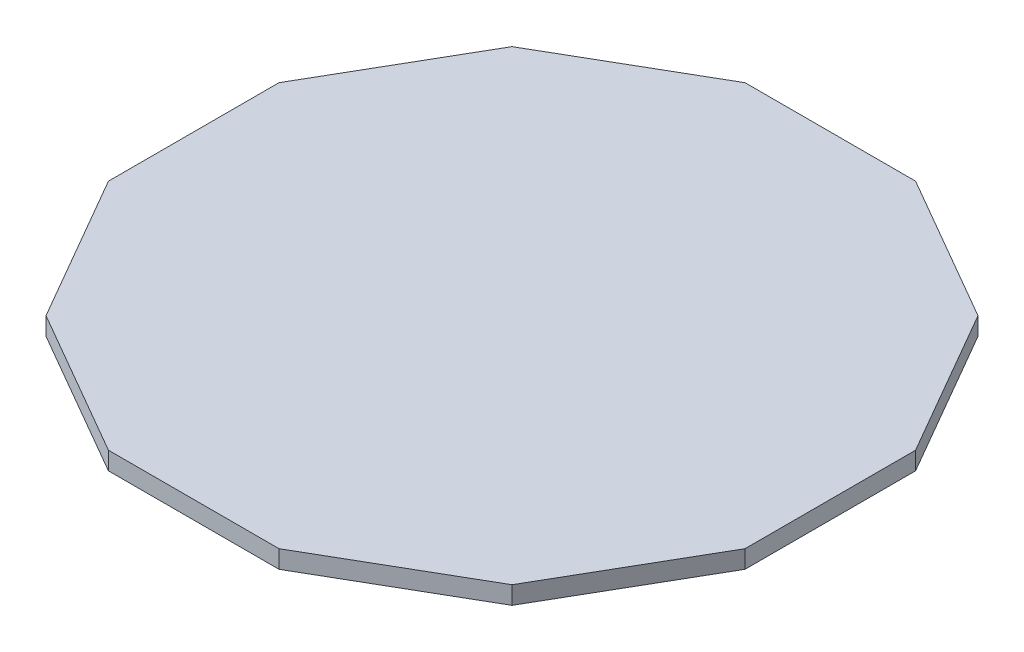
from build123d import *

# Parameters (mm, degrees)
BOSS_EXTRUDE1_DEPTH = 2.921
BOSS_EXTRUDE2_DEPTH = 2.921


with BuildPart() as part:
    # Sketch1 → Boss-Extrude1 (new body)
    with BuildSketch(Plane(origin=(0, 0, 0), x_dir=(1, 0, 0), z_dir=(0, 1, 0))):
        Polygon((49.069031975, 13.148007491), (35.921024484, 35.921024484), (13.148007491, 49.069031975), (-13.148007491, 49.069031975), (-35.921024484, 35.921024484), (-49.069031975, 13.148007491), (-49.069031975, -13.148007491), (-35.921024484, -35.921024484), (-13.148007491, -49.069031975), (13.148007491, -49.069031975), (35.921024484, -35.921024484), (49.069031975, -13.148007491), align=None)
    extrude(amount=-BOSS_EXTRUDE1_DEPTH)

    # Sketch2 → Boss-Extrude2 (add)
    with BuildSketch(Plane(origin=(0, 0, 0), x_dir=(1, 0, 0), z_dir=(0, 1, 0))):
        Polygon((51.990031975, 13.930687082), (38.059344893, 38.059344893), (13.930687082, 51.990031975), (-13.930687082, 51.990031975), (-38.059344893, 38.059344893), (-51.990031975, 13.930687082), (-51.990031975, -13.930687082), (-38.059344893, -38.059344893), (-13.930687082, -51.990031975), (13.930687082, -51.990031975), (38.059344893, -38.059344893), (51.990031975, -13.930687082), align=None)
        Polygon((49.069031975, 13.148007491), (35.921024484, 35.921024484), (13.148007491, 49.069031975), (-13.148007491, 49.069031975), (-35.921024484, 35.921024484), (-49.069031975, 13.148007491), (-49.069031975, -13.148007491), (-35.921024484, -35.921024484), (-13.148007491, -49.069031975), (13.148007491, -49.069031975), (35.921024484, -35.921024484), (49.069031975, -13.148007491), align=None, mode=Mode.SUBTRACT)
    extrude(amount=-BOSS_EXTRUDE2_DEPTH)


solid = part.part
